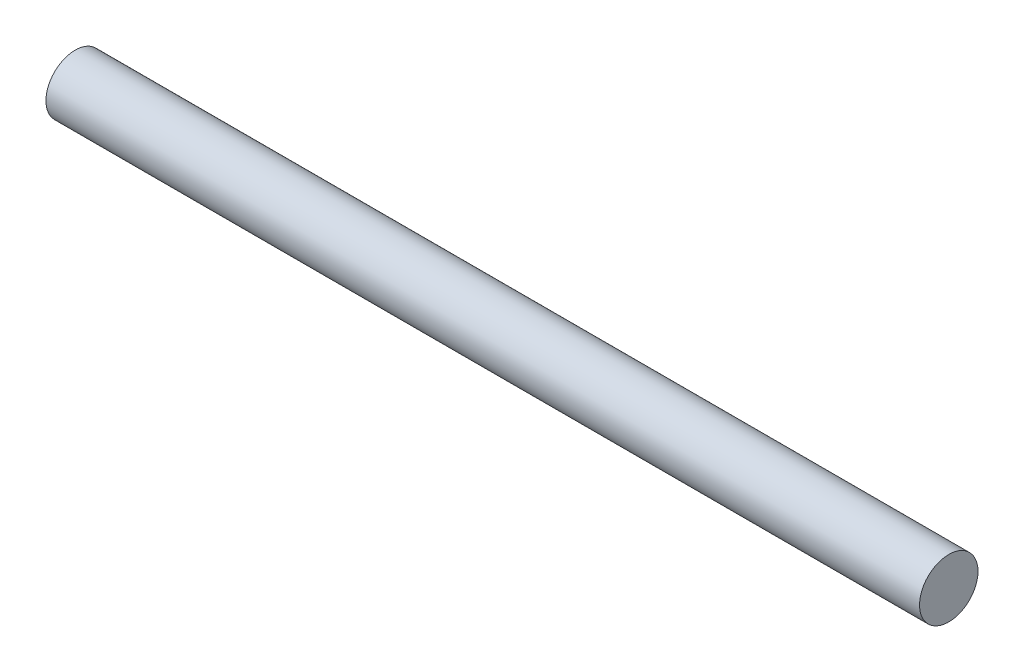
from build123d import *

# Parameters (mm, degrees)
SKETCH1_R           = 8.5
BOSS_EXTRUDE1_DEPTH = 254


with BuildPart() as part:
    # Sketch1 → Boss-Extrude1 (new body)
    with BuildSketch(Plane(origin=(0, 0, 0), x_dir=(0, 0, -1), z_dir=(1, 0, 0))):
        Circle(SKETCH1_R)
    extrude(amount=BOSS_EXTRUDE1_DEPTH)


solid = part.part
